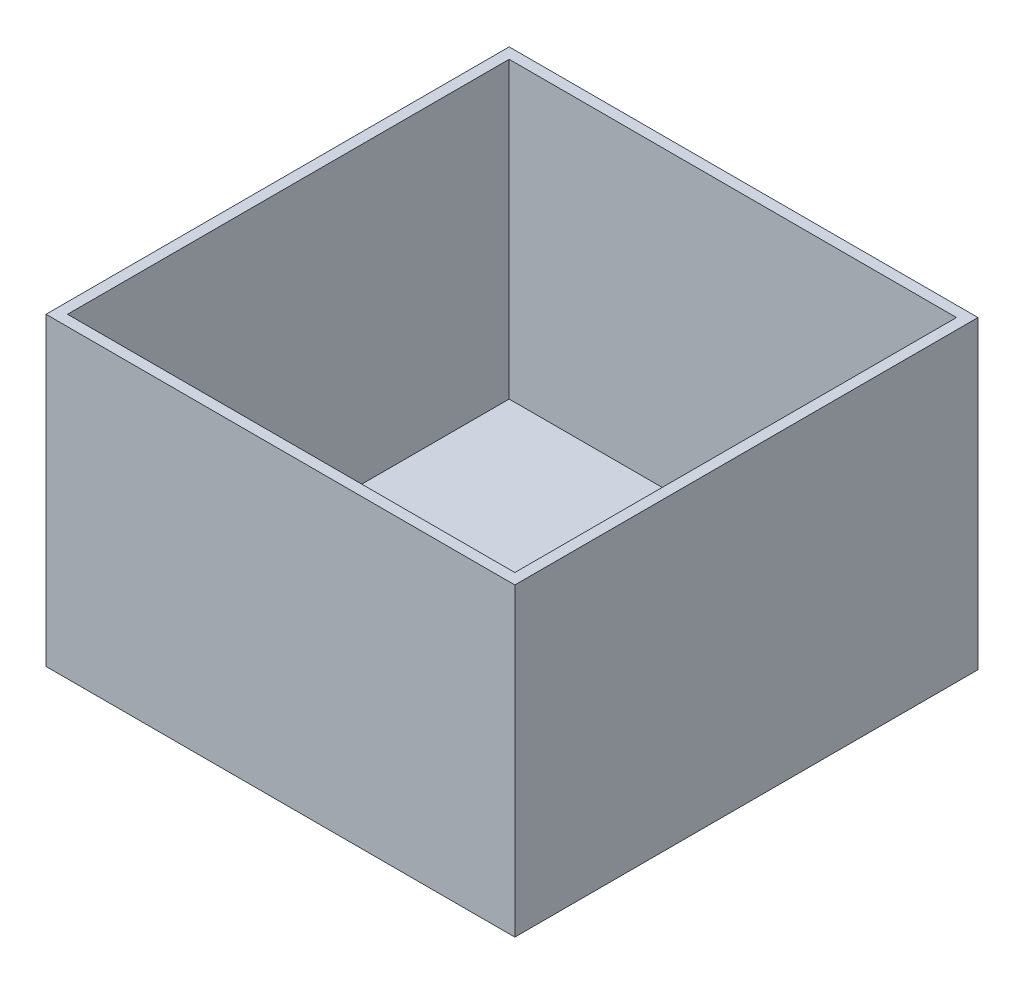
from build123d import *

# Parameters (mm, degrees)
SKETCH1_W           = 415
SKETCH1_H           = 410
BOSS_EXTRUDE1_DEPTH = 270
SKETCH2_W           = 395.95
SKETCH2_H           = 390.95
CUT_EXTRUDE1_DEPTH  = 260.475


with BuildPart() as part:
    # Sketch1 → Boss-Extrude1 (new body)
    with BuildSketch(Plane(origin=(0, 0, 0), x_dir=(1, 0, 0), z_dir=(0, 1, 0))):
        Rectangle(SKETCH1_W, SKETCH1_H)
    extrude(amount=BOSS_EXTRUDE1_DEPTH)

    # Sketch2 → Cut-Extrude1 (cut)
    with BuildSketch(Plane(origin=(0, 270, 0), x_dir=(1, 0, 0), z_dir=(0, 1, 0))):
        Rectangle(SKETCH2_W, SKETCH2_H)
    extrude(amount=-CUT_EXTRUDE1_DEPTH, mode=Mode.SUBTRACT)


solid = part.part
